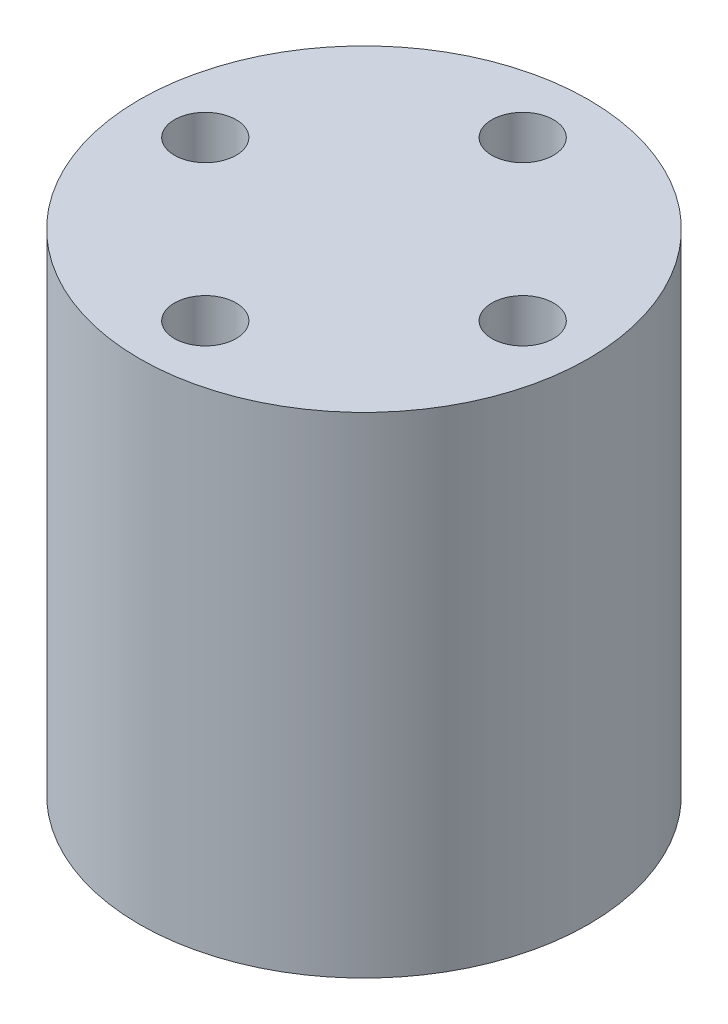
from build123d import *

# Parameters (mm, degrees)
SKETCH1_R           = 16
SKETCH1_R_2         = 2.2
BOSS_EXTRUDE1_DEPTH = 34.925


with BuildPart() as part:
    # Sketch1 → Boss-Extrude1 (new body)
    with BuildSketch(Plane(origin=(0, 0, 0), x_dir=(1, 0, 0), z_dir=(0, 1, 0))):
        with Locations(Location((0, 0, 0), (0, 0, 270))):
            Circle(SKETCH1_R)
        with Locations(Location((0, -11.313708499, 0), (0, 0, 270))):
            Circle(SKETCH1_R_2, mode=Mode.SUBTRACT)
        with Locations(Location((11.313708499, 0, 0), (0, 0, 270))):
            Circle(SKETCH1_R_2, mode=Mode.SUBTRACT)
        with Locations(Location((0, 11.313708499, 0), (0, 0, 270))):
            Circle(SKETCH1_R_2, mode=Mode.SUBTRACT)
        with Locations(Location((-11.313708499, 0, 0), (0, 0, 270))):
            Circle(SKETCH1_R_2, mode=Mode.SUBTRACT)
    extrude(amount=BOSS_EXTRUDE1_DEPTH)


solid = part.part
